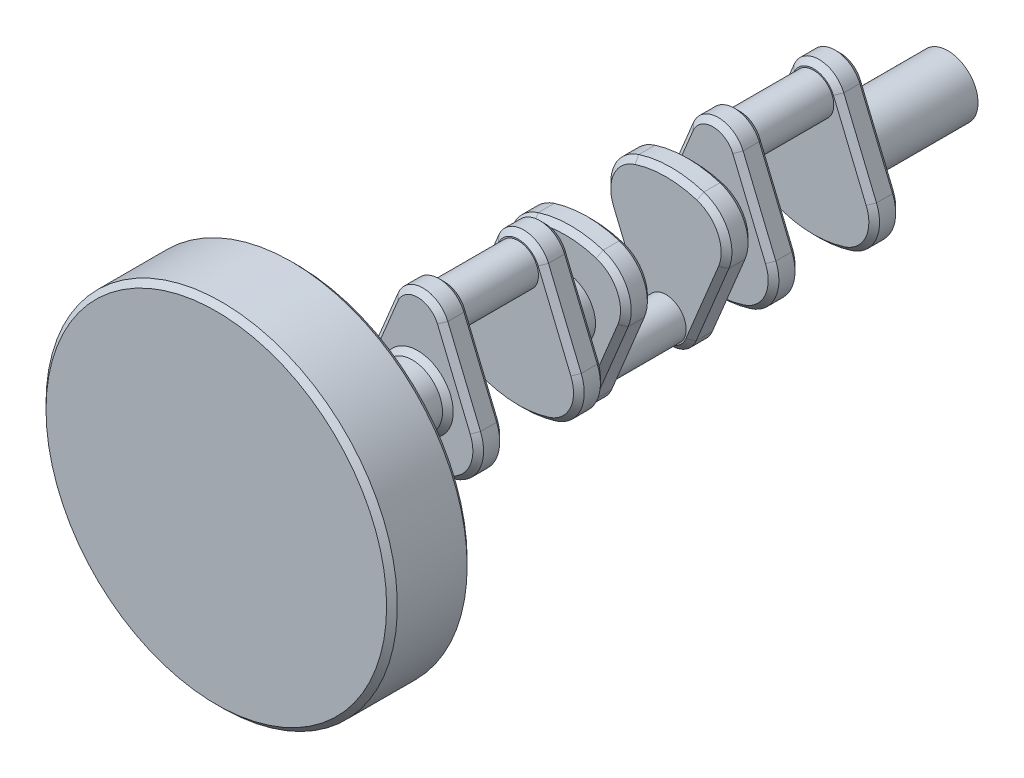
from build123d import *

# Parameters (mm, degrees)
SKETCH1_R             = 9.525
BOSS_EXTRUDE1_DEPTH   = 34.925
BOSS_EXTRUDE2_DEPTH   = 12.7
FILLET1_R             = 19.05
SKETCH3_R             = 14.2875
BOSS_EXTRUDE3_DEPTH   = 9.525
LPATTERN1_COUNT       = 3
LPATTERN1_PITCH       = 69.85
BODY_MOVE_COPY1_ANGLE = 180
LPATTERN2_COUNT       = 2
LPATTERN2_PITCH       = 69.85
SKETCH4_R             = 14.2875
BOSS_EXTRUDE4_DEPTH   = 57.15
BOSS_EXTRUDE5_START   = 50.8
SKETCH5_R             = 14.2875
BOSS_EXTRUDE5_DEPTH   = 50.8
SKETCH6_R             = 83.107085054
BOSS_EXTRUDE6_DEPTH   = 38.1
CHAMFER1_SIZE         = 2.54


with BuildPart() as part:
    # Sketch1 → Boss-Extrude1 (new body)
    with BuildSketch(Plane.XY):
        Circle(SKETCH1_R)
    extrude(amount=-BOSS_EXTRUDE1_DEPTH)

    # Sketch2 → Boss-Extrude2 (add)
    with BuildSketch(Plane(origin=(0, 0, -34.925), x_dir=(-1, 0, 0), z_dir=(0, 0, -1))):
        with BuildLine():
            Line((-11.733270063, 4.860079591), (-33.507418174, -47.707364088))
            ThreePointArc((-33.507418174, -47.707364088), (0, -60.325), (33.507418174, -47.707364088))
            Line((33.507418174, -47.707364088), (11.733270063, 4.860079591))
            ThreePointArc((11.733270063, 4.860079591), (0, 12.7), (-11.733270063, 4.860079591))
        make_face()
    extrude(amount=BOSS_EXTRUDE2_DEPTH)

    # Fillet1
    fillet1_edges = [part.edges().sort_by_distance(p)[0] for p in [
        (33.507418174, -47.707364088, -41.275),
        (-33.507418174, -47.707364088, -41.275),
    ]]
    fillet(fillet1_edges, radius=FILLET1_R)

    # Mirror2: part across plane


with BuildPart() as part_1:
    add(part.part)
    add(part.part.mirror(Plane.XY.offset(-17.4625)))


with BuildPart() as body_2:
    # Sketch3 → Boss-Extrude3 (new body)
    with BuildSketch(Plane(origin=(0, 0, -47.625), x_dir=(-1, 0, 0), z_dir=(0, 0, -1))):
        with Locations((0, -28.486474017)):
            Circle(SKETCH3_R)
    boss_extrude3 = extrude(amount=BOSS_EXTRUDE3_DEPTH)


with BuildPart() as lpattern1_1:
    # LPattern1: pattern copy
    add(part_1.part.moved(Location(Vector(0, 0, -1) * (1 * LPATTERN1_PITCH))))


with BuildPart() as lpattern1_2:
    # LPattern1: pattern copy
    add(part_1.part.moved(Location(Vector(0, 0, -1) * (2 * LPATTERN1_PITCH))))

    # Sketch5 → Boss-Extrude5 (add)
    with BuildSketch(Plane(origin=(0, 0, -187.325), x_dir=(-1, 0, 0), z_dir=(0, 0, -1)).offset(BOSS_EXTRUDE5_START)):
        with Locations((0, -28.486474017)):
            Circle(SKETCH5_R)
    extrude(amount=-BOSS_EXTRUDE5_DEPTH)


with BuildPart() as lpattern1_1_1:
    # Body-Move/Copy1: moved
    add(lpattern1_1.part.rotate(Axis((0, -28.486474017, 0), (0, 0, 1)), BODY_MOVE_COPY1_ANGLE))


with BuildPart() as lpattern2_1:
    # LPattern2: Boss-Extrude3 ×2
    with Locations(*[(0, 0, -i * LPATTERN2_PITCH) for i in range(1, LPATTERN2_COUNT)]):
        add(boss_extrude3)


with BuildPart() as part_2:
    add(part_1.part)

    # Sketch4 → Boss-Extrude4 (add)
    with BuildSketch(Plane.XY.offset(12.7)):
        with Locations((0, -28.486474017)):
            Circle(SKETCH4_R)
    extrude(amount=BOSS_EXTRUDE4_DEPTH)

    # Sketch6 → Boss-Extrude6 (add)
    with BuildSketch(Plane.XY.offset(69.85)):
        with Locations((0, -28.486474017)):
            Circle(SKETCH6_R)
    extrude(amount=BOSS_EXTRUDE6_DEPTH)


with BuildPart() as body_2_1:
    add(body_2.part)

    # Combine1: union LPattern1_1, LPattern2_1, LPattern1_2, part
    add(lpattern1_1_1.part)
    add(lpattern2_1.part)
    add(lpattern1_2.part)
    add(part_2.part)

    # Chamfer1
    chamfer1_edges = [body_2_1.edges().sort_by_distance(p)[0] for p in [
        (14.2875, -28.486474017, -187.325),
        (-14.2875, -28.486474017, 12.7),
        (-14.2875, -28.486474017, 69.85),
        (-26.88006293, -47.820548612, -174.625),
        (-19.470080331, -13.818232688, -174.625),
        (0, -60.325, -174.625),
        (0, 12.7, -174.625),
        (26.88006293, -47.820548612, -174.625),
        (19.470080331, -13.818232688, -174.625),
        (-26.88006293, -47.820548612, -187.325),
        (-19.470080331, -13.818232688, -187.325),
        (0, -60.325, -187.325),
        (0, 12.7, -187.325),
        (26.88006293, -47.820548612, -187.325),
        (19.470080331, -13.818232688, -187.325),
        (-26.88006293, -47.820548612, -139.7),
        (-19.470080331, -13.818232688, -139.7),
        (0, -60.325, -139.7),
        (0, 12.7, -139.7),
        (26.88006293, -47.820548612, -139.7),
        (19.470080331, -13.818232688, -139.7),
        (-26.88006293, -47.820548612, -127),
        (-19.470080331, -13.818232688, -127),
        (0, -60.325, -127),
        (0, 12.7, -127),
        (26.88006293, -47.820548612, -127),
        (19.470080331, -13.818232688, -127),
        (-19.470080331, -43.154715345, -117.475),
        (-26.88006293, -9.152399421, -117.475),
        (0, -69.672948033, -117.475),
        (0, 3.352051967, -117.475),
        (19.470080331, -43.154715345, -117.475),
        (26.88006293, -9.152399421, -117.475),
        (-19.470080331, -43.154715345, -104.775),
        (0, -69.672948033, -104.775),
        (-26.88006293, -9.152399421, -104.775),
        (19.470080331, -43.154715345, -104.775),
        (0, 3.352051967, -104.775),
        (26.88006293, -9.152399421, -104.775),
        (-19.470080331, -43.154715345, -69.85),
        (0, -69.672948033, -69.85),
        (-26.88006293, -9.152399421, -69.85),
        (19.470080331, -43.154715345, -69.85),
        (0, 3.352051967, -69.85),
        (26.88006293, -9.152399421, -69.85),
        (-19.470080331, -43.154715345, -57.15),
        (-26.88006293, -9.152399421, -57.15),
        (0, -69.672948033, -57.15),
        (0, 3.352051967, -57.15),
        (19.470080331, -43.154715345, -57.15),
        (26.88006293, -9.152399421, -57.15),
        (-19.470080331, -13.818232688, -47.625),
        (0, 12.7, -47.625),
        (-26.88006293, -47.820548612, -47.625),
        (19.470080331, -13.818232688, -47.625),
        (0, -60.325, -47.625),
        (26.88006293, -47.820548612, -47.625),
        (-19.470080331, -13.818232688, -34.925),
        (-26.88006293, -47.820548612, -34.925),
        (0, 12.7, -34.925),
        (0, -60.325, -34.925),
        (19.470080331, -13.818232688, -34.925),
        (26.88006293, -47.820548612, -34.925),
        (-19.470080331, -13.818232688, 0),
        (-26.88006293, -47.820548612, 0),
        (0, 12.7, 0),
        (0, -60.325, 0),
        (19.470080331, -13.818232688, 0),
        (26.88006293, -47.820548612, 0),
        (-19.470080331, -13.818232688, 12.7),
        (0, 12.7, 12.7),
        (-26.88006293, -47.820548612, 12.7),
        (19.470080331, -13.818232688, 12.7),
        (0, -60.325, 12.7),
        (26.88006293, -47.820548612, 12.7),
        (-83.107085054, -28.486474017, 69.85),
        (-83.107085054, -28.486474017, 107.95),
    ]]
    chamfer(chamfer1_edges, length=CHAMFER1_SIZE)


solid = body_2_1.part
